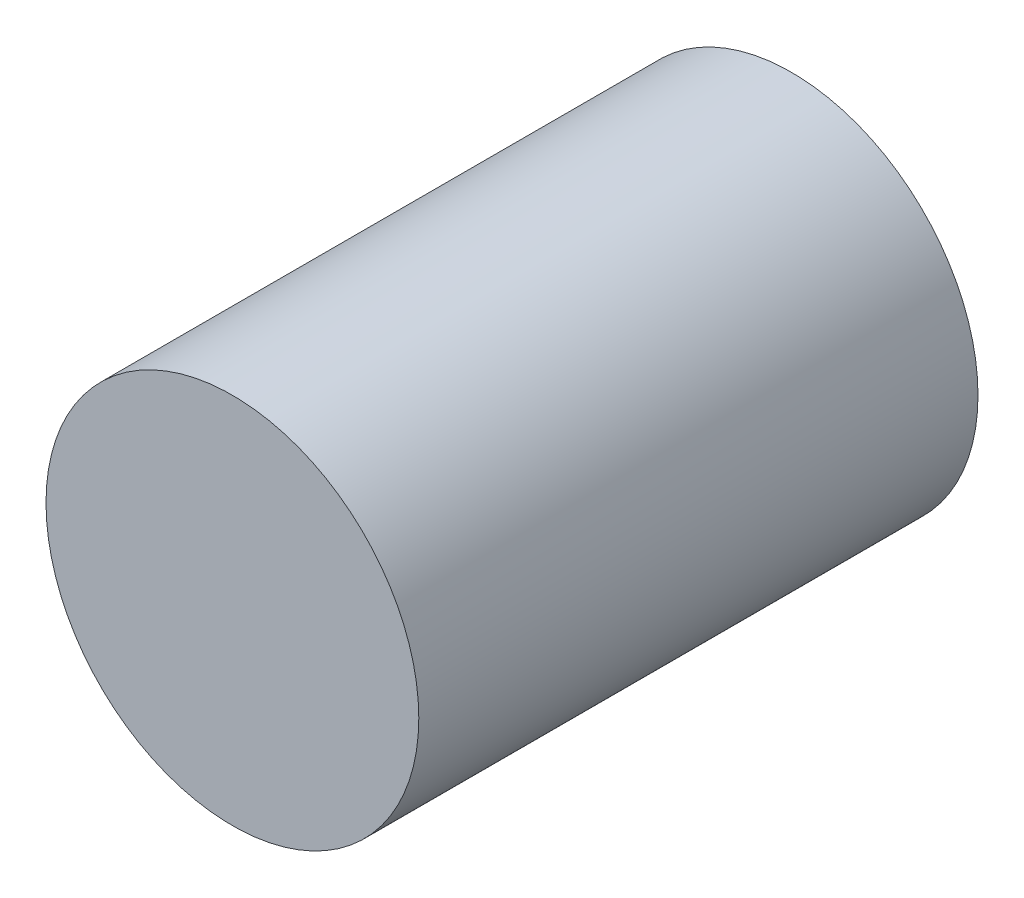
from build123d import *

# Parameters (mm, degrees)
SKETCH_1_R      = 4
EXTRUDE_1_DEPTH = 12


with BuildPart() as part:
    # 草图1 → 凸台-拉伸1 (new body)
    with BuildSketch(Plane.XY):
        Circle(SKETCH_1_R)
    extrude(amount=EXTRUDE_1_DEPTH)


solid = part.part
